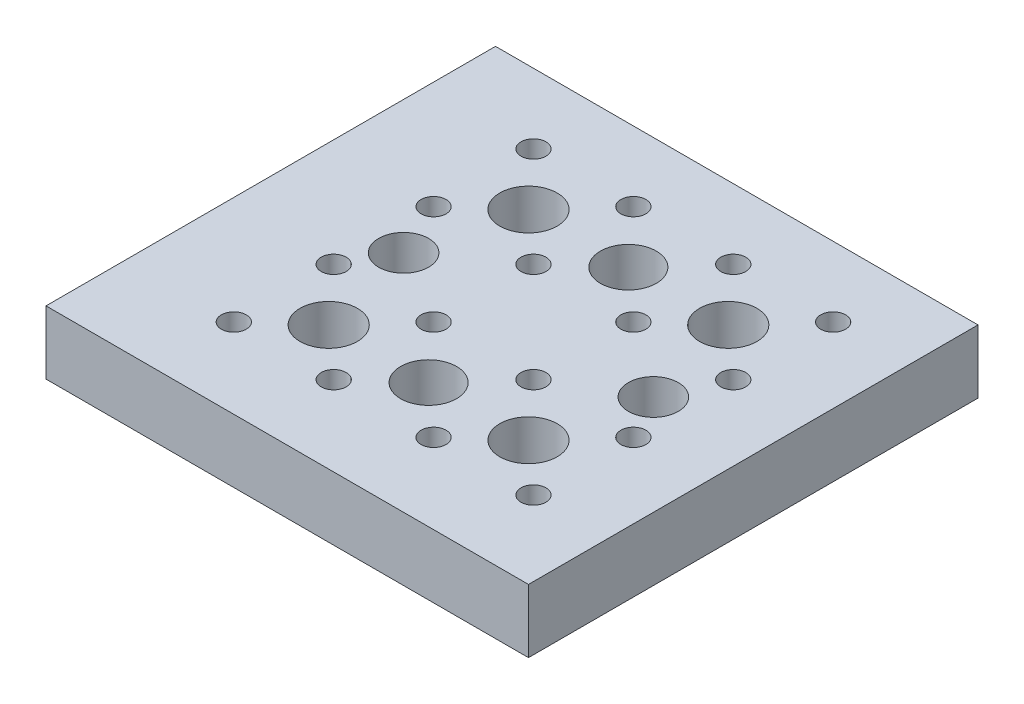
from build123d import *

# Parameters (mm, degrees)
SKETCH1_W           = 48.3
SKETCH1_H           = 45
SKETCH1_R           = 2.875
SKETCH1_R_2         = 1.25
SKETCH1_R_3         = 2.8
SKETCH1_R_4         = 2.5
BOSS_EXTRUDE1_DEPTH = 6.35


with BuildPart() as part:
    # Sketch1 → Boss-Extrude1 (new body)
    with BuildSketch(Plane(origin=(0, 0, 0), x_dir=(1, 0, 0), z_dir=(0, 1, 0))):
        with Locations((24.15, -22.5)):
            Rectangle(SKETCH1_W, SKETCH1_H)
        with Locations(Location((15.8, -12.5, 0), (0, 0, 270))):
            Circle(SKETCH1_R, mode=Mode.SUBTRACT)
        with Locations(Location((35.8, -12.5, 0), (0, 0, 270))):
            Circle(SKETCH1_R, mode=Mode.SUBTRACT)
        with Locations(Location((15.8, -32.5, 0), (0, 0, 270))):
            Circle(SKETCH1_R, mode=Mode.SUBTRACT)
        with Locations(Location((35.8, -32.5, 0), (0, 0, 270))):
            Circle(SKETCH1_R, mode=Mode.SUBTRACT)
        with Locations(Location((10.8, -7, 0), (0, 0, 270))):
            Circle(SKETCH1_R_2, mode=Mode.SUBTRACT)
        with Locations(Location((20.8, -7, 0), (0, 0, 270))):
            Circle(SKETCH1_R_2, mode=Mode.SUBTRACT)
        with Locations(Location((30.8, -7, 0), (0, 0, 270))):
            Circle(SKETCH1_R_2, mode=Mode.SUBTRACT)
        with Locations(Location((40.8, -7, 0), (0, 0, 270))):
            Circle(SKETCH1_R_2, mode=Mode.SUBTRACT)
        with Locations(Location((20.8, -17, 0), (0, 0, 270))):
            Circle(SKETCH1_R_2, mode=Mode.SUBTRACT)
        with Locations(Location((30.8, -17, 0), (0, 0, 270))):
            Circle(SKETCH1_R_2, mode=Mode.SUBTRACT)
        with Locations(Location((40.8, -17, 0), (0, 0, 270))):
            Circle(SKETCH1_R_2, mode=Mode.SUBTRACT)
        with Locations(Location((20.8, -27, 0), (0, 0, 270))):
            Circle(SKETCH1_R_2, mode=Mode.SUBTRACT)
        with Locations(Location((30.8, -27, 0), (0, 0, 270))):
            Circle(SKETCH1_R_2, mode=Mode.SUBTRACT)
        with Locations(Location((40.8, -27, 0), (0, 0, 270))):
            Circle(SKETCH1_R_2, mode=Mode.SUBTRACT)
        with Locations(Location((20.8, -37, 0), (0, 0, 270))):
            Circle(SKETCH1_R_2, mode=Mode.SUBTRACT)
        with Locations(Location((30.8, -37, 0), (0, 0, 270))):
            Circle(SKETCH1_R_2, mode=Mode.SUBTRACT)
        with Locations(Location((40.8, -37, 0), (0, 0, 270))):
            Circle(SKETCH1_R_2, mode=Mode.SUBTRACT)
        with Locations(Location((10.8, -17, 0), (0, 0, 270))):
            Circle(SKETCH1_R_2, mode=Mode.SUBTRACT)
        with Locations(Location((10.8, -27, 0), (0, 0, 270))):
            Circle(SKETCH1_R_2, mode=Mode.SUBTRACT)
        with Locations(Location((10.8, -37, 0), (0, 0, 270))):
            Circle(SKETCH1_R_2, mode=Mode.SUBTRACT)
        with Locations(Location((25.8, -12.5, 0), (0, 0, 270))):
            Circle(SKETCH1_R_3, mode=Mode.SUBTRACT)
        with Locations(Location((25.8, -32.5, 0), (0, 0, 270))):
            Circle(SKETCH1_R_3, mode=Mode.SUBTRACT)
        with Locations(Location((13.3, -22.5, 0), (0, 0, 270))):
            Circle(SKETCH1_R_4, mode=Mode.SUBTRACT)
        with Locations(Location((38.3, -22.5, 0), (0, 0, 270))):
            Circle(SKETCH1_R_4, mode=Mode.SUBTRACT)
    extrude(amount=BOSS_EXTRUDE1_DEPTH)


solid = part.part
